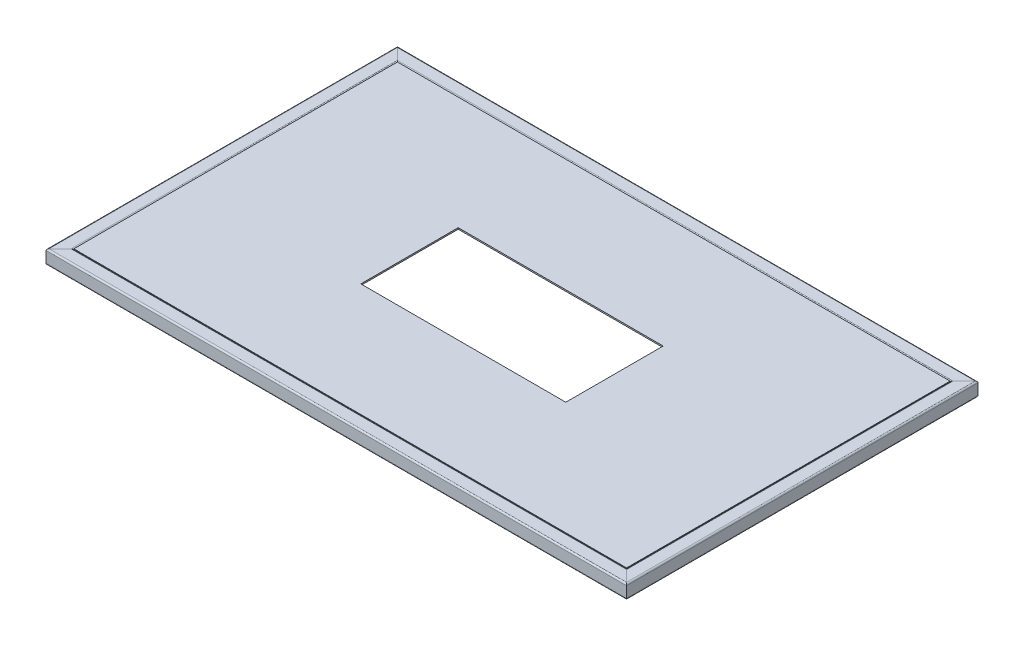
from build123d import *

# Parameters (mm, degrees)
TUBO_CUADRADO_2_X_2_X_0_25_1_DEPTH      = 507.940768363
TUBO_CUADRADO_2_X_2_X_0_25_1_DEPTH_BACK = 27.940768363
TUBO_CUADRADO_2_X_2_X_0_25_1_2_DEPTH    = 848.881536726
TUBO_CUADRADO_2_X_2_X_0_25_1_3_DEPTH    = 535.881536726
TUBO_CUADRADO_2_X_2_X_0_25_1_4_DEPTH    = 848.881536726
CROQUIS2_W                              = 754.9
CROQUIS2_H                              = 441.9
SALIENTE_EXTRUIR1_DEPTH                 = 12.7
VACIADO1_T                              = -1.9
CROQUIS3_W                              = 280
CROQUIS3_H                              = 133
CORTAR_EXTRUIR1_DEPTH                   = 10


with BuildPart() as part:
    # Sketch1 → Tubo cuadrado 2 X 2 X 0.25(1) (new, two sides: drawn at the far end of the back side and taken through both)
    with BuildSketch(Plane(origin=(-386.975, 9.525, -240), x_dir=(1, 0, 0), z_dir=(0, 0, 1)).offset(-TUBO_CUADRADO_2_X_2_X_0_25_1_DEPTH_BACK)):
        with BuildLine():
            Line((-7.525, -9.525), (7.525, -9.525))
            ThreePointArc((7.525, -9.525), (8.939213562, -8.939213562), (9.525, -7.525))
            Line((9.525, -7.525), (9.525, 7.525))
            ThreePointArc((9.525, 7.525), (8.939213562, 8.939213562), (7.525, 9.525))
            Line((7.525, 9.525), (-7.525, 9.525))
            ThreePointArc((-7.525, 9.525), (-8.939213562, 8.939213562), (-9.525, 7.525))
            Line((-9.525, 7.525), (-9.525, -7.525))
            ThreePointArc((-9.525, -7.525), (-8.939213562, -8.939213562), (-7.525, -9.525))
        make_face()
        with BuildLine():
            Line((-7.525, -8.525), (7.525, -8.525))
            ThreePointArc((7.525, -8.525), (8.232106781, -8.232106781), (8.525, -7.525))
            Line((8.525, -7.525), (8.525, 7.525))
            ThreePointArc((8.525, 7.525), (8.232106781, 8.232106781), (7.525, 8.525))
            Line((7.525, 8.525), (-7.525, 8.525))
            ThreePointArc((-7.525, 8.525), (-8.232106781, 8.232106781), (-8.525, 7.525))
            Line((-8.525, 7.525), (-8.525, -7.525))
            ThreePointArc((-8.525, -7.525), (-8.232106781, -8.232106781), (-7.525, -8.525))
        make_face(mode=Mode.SUBTRACT)
    extrude(amount=TUBO_CUADRADO_2_X_2_X_0_25_1_DEPTH + TUBO_CUADRADO_2_X_2_X_0_25_1_DEPTH_BACK)

    # Tubo cuadrado 2 X 2 X 0.25(1) mitre 1
    split(bisect_by=Plane(origin=(-396.5, 0, -240), x_dir=(0, -1, 0), z_dir=(-0.707106781, 0, 0.707106781)), keep=Keep.TOP)

    # Tubo cuadrado 2 X 2 X 0.25(1) mitre 2
    split(bisect_by=Plane(origin=(-396.5, 0, 240), x_dir=(0, -1, 0), z_dir=(-0.707106781, 0, -0.707106781)), keep=Keep.TOP)


with BuildPart() as body_2:
    # Sketch1 on segment 2 (carried to segment 2) → Tubo cuadrado 2 X 2 X 0.25_1 2 (new body)
    with BuildSketch(Plane(origin=(-424.440768363, 9.525, 230.475), x_dir=(0, 0, -1), z_dir=(1, 0, 0))):
        with BuildLine():
            Line((-7.525, -9.525), (7.525, -9.525))
            ThreePointArc((7.525, -9.525), (8.939213562, -8.939213562), (9.525, -7.525))
            Line((9.525, -7.525), (9.525, 7.525))
            ThreePointArc((9.525, 7.525), (8.939213562, 8.939213562), (7.525, 9.525))
            Line((7.525, 9.525), (-7.525, 9.525))
            ThreePointArc((-7.525, 9.525), (-8.939213562, 8.939213562), (-9.525, 7.525))
            Line((-9.525, 7.525), (-9.525, -7.525))
            ThreePointArc((-9.525, -7.525), (-8.939213562, -8.939213562), (-7.525, -9.525))
        make_face()
        with BuildLine():
            Line((-7.525, -8.525), (7.525, -8.525))
            ThreePointArc((7.525, -8.525), (8.232106781, -8.232106781), (8.525, -7.525))
            Line((8.525, -7.525), (8.525, 7.525))
            ThreePointArc((8.525, 7.525), (8.232106781, 8.232106781), (7.525, 8.525))
            Line((7.525, 8.525), (-7.525, 8.525))
            ThreePointArc((-7.525, 8.525), (-8.232106781, 8.232106781), (-8.525, 7.525))
            Line((-8.525, 7.525), (-8.525, -7.525))
            ThreePointArc((-8.525, -7.525), (-8.232106781, -8.232106781), (-7.525, -8.525))
        make_face(mode=Mode.SUBTRACT)
    extrude(amount=TUBO_CUADRADO_2_X_2_X_0_25_1_2_DEPTH)

    # Tubo cuadrado 2 X 2 X 0.25_1 2 mitre 1
    split(bisect_by=Plane(origin=(-396.5, 0, 240), x_dir=(0, 1, 0), z_dir=(0.707106781, 0, 0.707106781)), keep=Keep.TOP)

    # Tubo cuadrado 2 X 2 X 0.25_1 2 mitre 2
    split(bisect_by=Plane(origin=(396.5, 0, 240), x_dir=(0, -1, 0), z_dir=(-0.707106781, 0, 0.707106781)), keep=Keep.TOP)


with BuildPart() as body_3:
    # Sketch1 on segment 3 (carried to segment 3) → Tubo cuadrado 2 X 2 X 0.25_1 3 (new body)
    with BuildSketch(Plane(origin=(386.975, 9.525, 267.940768363), x_dir=(-1, 0, 0), z_dir=(0, 0, -1))):
        with BuildLine():
            Line((-7.525, -9.525), (7.525, -9.525))
            ThreePointArc((7.525, -9.525), (8.939213562, -8.939213562), (9.525, -7.525))
            Line((9.525, -7.525), (9.525, 7.525))
            ThreePointArc((9.525, 7.525), (8.939213562, 8.939213562), (7.525, 9.525))
            Line((7.525, 9.525), (-7.525, 9.525))
            ThreePointArc((-7.525, 9.525), (-8.939213562, 8.939213562), (-9.525, 7.525))
            Line((-9.525, 7.525), (-9.525, -7.525))
            ThreePointArc((-9.525, -7.525), (-8.939213562, -8.939213562), (-7.525, -9.525))
        make_face()
        with BuildLine():
            Line((-7.525, -8.525), (7.525, -8.525))
            ThreePointArc((7.525, -8.525), (8.232106781, -8.232106781), (8.525, -7.525))
            Line((8.525, -7.525), (8.525, 7.525))
            ThreePointArc((8.525, 7.525), (8.232106781, 8.232106781), (7.525, 8.525))
            Line((7.525, 8.525), (-7.525, 8.525))
            ThreePointArc((-7.525, 8.525), (-8.232106781, 8.232106781), (-8.525, 7.525))
            Line((-8.525, 7.525), (-8.525, -7.525))
            ThreePointArc((-8.525, -7.525), (-8.232106781, -8.232106781), (-7.525, -8.525))
        make_face(mode=Mode.SUBTRACT)
    extrude(amount=TUBO_CUADRADO_2_X_2_X_0_25_1_3_DEPTH)

    # Tubo cuadrado 2 X 2 X 0.25_1 3 mitre 1
    split(bisect_by=Plane(origin=(396.5, 0, -240), x_dir=(0, 1, 0), z_dir=(0.707106781, 0, 0.707106781)), keep=Keep.TOP)

    # Tubo cuadrado 2 X 2 X 0.25_1 3 mitre 2
    split(bisect_by=Plane(origin=(396.5, 0, 240), x_dir=(0, 1, 0), z_dir=(0.707106781, 0, -0.707106781)), keep=Keep.TOP)


with BuildPart() as body_4:
    # Sketch1 on segment 4 (carried to segment 4) → Tubo cuadrado 2 X 2 X 0.25_1 4 (new body)
    with BuildSketch(Plane(origin=(424.440768363, 9.525, -230.475), x_dir=(0, 0, 1), z_dir=(-1, 0, 0))):
        with BuildLine():
            Line((-7.525, -9.525), (7.525, -9.525))
            ThreePointArc((7.525, -9.525), (8.939213562, -8.939213562), (9.525, -7.525))
            Line((9.525, -7.525), (9.525, 7.525))
            ThreePointArc((9.525, 7.525), (8.939213562, 8.939213562), (7.525, 9.525))
            Line((7.525, 9.525), (-7.525, 9.525))
            ThreePointArc((-7.525, 9.525), (-8.939213562, 8.939213562), (-9.525, 7.525))
            Line((-9.525, 7.525), (-9.525, -7.525))
            ThreePointArc((-9.525, -7.525), (-8.939213562, -8.939213562), (-7.525, -9.525))
        make_face()
        with BuildLine():
            Line((-7.525, -8.525), (7.525, -8.525))
            ThreePointArc((7.525, -8.525), (8.232106781, -8.232106781), (8.525, -7.525))
            Line((8.525, -7.525), (8.525, 7.525))
            ThreePointArc((8.525, 7.525), (8.232106781, 8.232106781), (7.525, 8.525))
            Line((7.525, 8.525), (-7.525, 8.525))
            ThreePointArc((-7.525, 8.525), (-8.232106781, 8.232106781), (-8.525, 7.525))
            Line((-8.525, 7.525), (-8.525, -7.525))
            ThreePointArc((-8.525, -7.525), (-8.232106781, -8.232106781), (-7.525, -8.525))
        make_face(mode=Mode.SUBTRACT)
    extrude(amount=TUBO_CUADRADO_2_X_2_X_0_25_1_4_DEPTH)

    # Tubo cuadrado 2 X 2 X 0.25_1 4 mitre 1
    split(bisect_by=Plane(origin=(-396.5, 0, -240), x_dir=(0, 1, 0), z_dir=(0.707106781, 0, -0.707106781)), keep=Keep.TOP)

    # Tubo cuadrado 2 X 2 X 0.25_1 4 mitre 2
    split(bisect_by=Plane(origin=(396.5, 0, -240), x_dir=(0, -1, 0), z_dir=(-0.707106781, 0, -0.707106781)), keep=Keep.TOP)


with BuildPart() as body_5:
    # Croquis2 → Saliente-Extruir1 (new body)
    with BuildSketch(Plane(origin=(0, 19.05, 0), x_dir=(1, 0, 0), z_dir=(0, 1, 0))):
        Rectangle(CROQUIS2_W, CROQUIS2_H)
    extrude(amount=-SALIENTE_EXTRUIR1_DEPTH)

    # Vaciado1
    vaciado1_openings = [body_5.faces().sort_by_distance(p)[0] for p in [
        (0, 6.35, 0),
    ]]
    offset(amount=VACIADO1_T, openings=vaciado1_openings, kind=Kind.INTERSECTION)

    # Croquis3 → Cortar-Extruir1 (cut)
    with BuildSketch(Plane(origin=(0, 17.15, 0), x_dir=(-1, 0, 0), z_dir=(0, -1, 0))):
        Rectangle(CROQUIS3_W, CROQUIS3_H)
    extrude(amount=-CORTAR_EXTRUIR1_DEPTH, mode=Mode.SUBTRACT)


solid = Compound([part.part, body_2.part, body_3.part, body_4.part, body_5.part])
